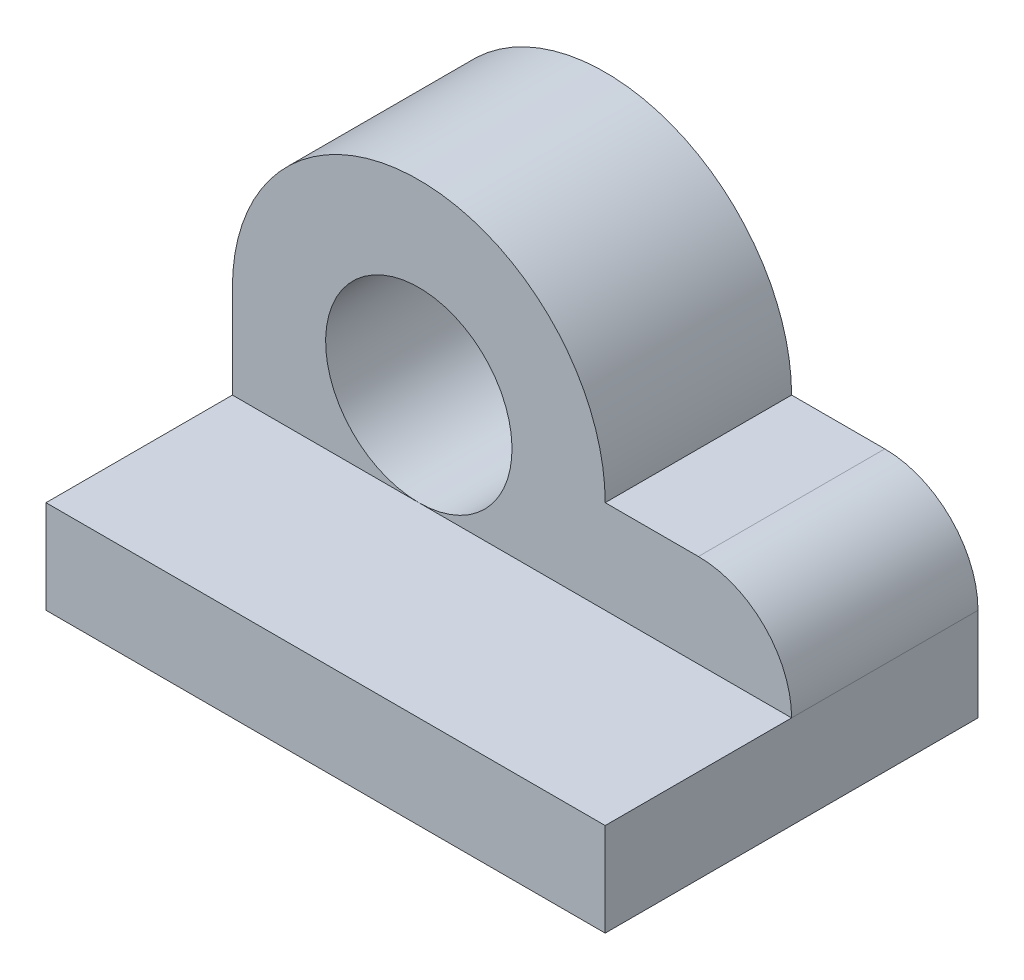
from build123d import *

# Parameters (mm, degrees)
SKETCH1_R           = 10
BOSS_EXTRUDE1_DEPTH = 20
SKETCH2_W           = 60
SKETCH2_H           = 10
BOSS_EXTRUDE2_DEPTH = 20


with BuildPart() as part:
    # Sketch1 → Boss-Extrude1 (new body)
    with BuildSketch(Plane.XY):
        with BuildLine():
            Line((-68.426781799, -7.635201306), (-8.426781799, -7.635201306))
            Line((-8.426781799, -7.635201306), (-8.426781799, 2.364798694))
            ThreePointArc((-8.426781799, 2.364798694), (-11.355713987, 9.435866506), (-18.426781799, 12.364798694))
            Line((-18.426781799, 12.364798694), (-28.426781799, 12.364798694))
            ThreePointArc((-28.426781799, 12.364798694), (-48.426781799, 32.364798694), (-68.426781799, 12.364798694))
            Line((-68.426781799, 12.364798694), (-68.426781799, -7.635201306))
        make_face()
        with Locations((-48.426781799, 12.364798694)):
            Circle(SKETCH1_R, mode=Mode.SUBTRACT)
    extrude(amount=BOSS_EXTRUDE1_DEPTH)

    # Sketch2 → Boss-Extrude2 (add)
    with BuildSketch(Plane.XY.offset(20)):
        with Locations((-38.426781799, -2.635201306)):
            Rectangle(SKETCH2_W, SKETCH2_H)
    extrude(amount=BOSS_EXTRUDE2_DEPTH)


solid = part.part
